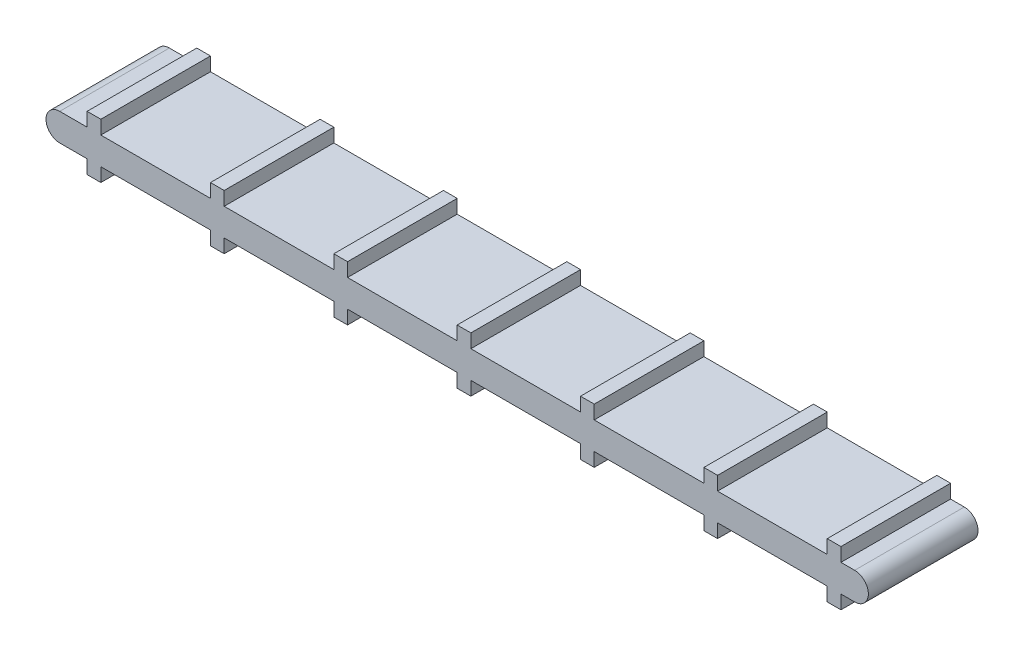
from build123d import *

# Parameters (mm, degrees)
SKETCH1_W           = 300
SKETCH1_H           = 40
BOSS_EXTRUDE1_DEPTH = 10
CUT_EXTRUDE1_DEPTH  = 40
CUT_EXTRUDE2_DEPTH  = 40
SKETCH5_W           = 5
SKETCH5_H           = 40
SKETCH5_W_2         = 2.5
BOSS_EXTRUDE3_DEPTH = 5


with BuildPart() as part:
    # Sketch1 → Boss-Extrude1 (new body)
    with BuildSketch(Plane(origin=(0, 0, 0), x_dir=(1, 0, 0), z_dir=(0, 1, 0))):
        with Locations((-150, 20)):
            Rectangle(SKETCH1_W, SKETCH1_H)
    extrude(amount=BOSS_EXTRUDE1_DEPTH)

    # Sketch2 → Cut-Extrude1 (cut)
    with BuildSketch(Plane(origin=(0, 0, -40), x_dir=(-1, 0, 0), z_dir=(0, 0, -1))):
        with BuildLine():
            Line((0, 10), (0, 5))
            ThreePointArc((0, 5), (1.464466094, 8.535533906), (5, 10))
            Line((5, 10), (0, 10))
        make_face()
        with BuildLine():
            ThreePointArc((5, 0), (1.464466094, 1.464466094), (0, 5))
            Line((0, 5), (0, 0))
            Line((0, 0), (5, 0))
        make_face()
    extrude(amount=-CUT_EXTRUDE1_DEPTH, mode=Mode.SUBTRACT)

    # Sketch4 → Cut-Extrude2 (cut)
    with BuildSketch(Plane(origin=(0, 0, -40), x_dir=(-1, 0, 0), z_dir=(0, 0, -1))):
        with BuildLine():
            Line((300, 10), (295, 10))
            ThreePointArc((295, 10), (298.535533906, 8.535533906), (300, 5))
            Line((300, 5), (300, 10))
        make_face()
        with BuildLine():
            Line((300, 0), (300, 5))
            ThreePointArc((300, 5), (298.535533906, 1.464466094), (295, 0))
            Line((295, 0), (300, 0))
        make_face()
    extrude(amount=-CUT_EXTRUDE2_DEPTH, mode=Mode.SUBTRACT)

    # Sketch5 → Boss-Extrude3 (add)
    with BuildSketch(Plane(origin=(0, 10, 0), x_dir=(1, 0, 0), z_dir=(0, 1, 0))):
        with Locations((-282.5, 20)):
            Rectangle(SKETCH5_W, SKETCH5_H)
        with Locations((-192.5, 20)):
            Rectangle(SKETCH5_W, SKETCH5_H)
        with Locations((-148.75, 20)):
            Rectangle(SKETCH5_W_2, SKETCH5_H)
        with Locations((-146.25, 20)):
            Rectangle(SKETCH5_W_2, SKETCH5_H)
        with Locations((-103.75, 20)):
            Rectangle(SKETCH5_W_2, SKETCH5_H)
        with Locations((-101.25, 20)):
            Rectangle(SKETCH5_W_2, SKETCH5_H)
        with Locations((-58.75, 20)):
            Rectangle(SKETCH5_W_2, SKETCH5_H)
        with Locations((-56.25, 20)):
            Rectangle(SKETCH5_W_2, SKETCH5_H)
        with Locations((-12.5, 20)):
            Rectangle(SKETCH5_W, SKETCH5_H)
        with Locations((-237.5, 20)):
            Rectangle(SKETCH5_W, SKETCH5_H)
    boss_extrude3 = extrude(amount=BOSS_EXTRUDE3_DEPTH)

    # Mirror2: Boss-Extrude3 across plane
    add(boss_extrude3.mirror(Plane.ZX.offset(5)))


solid = part.part
